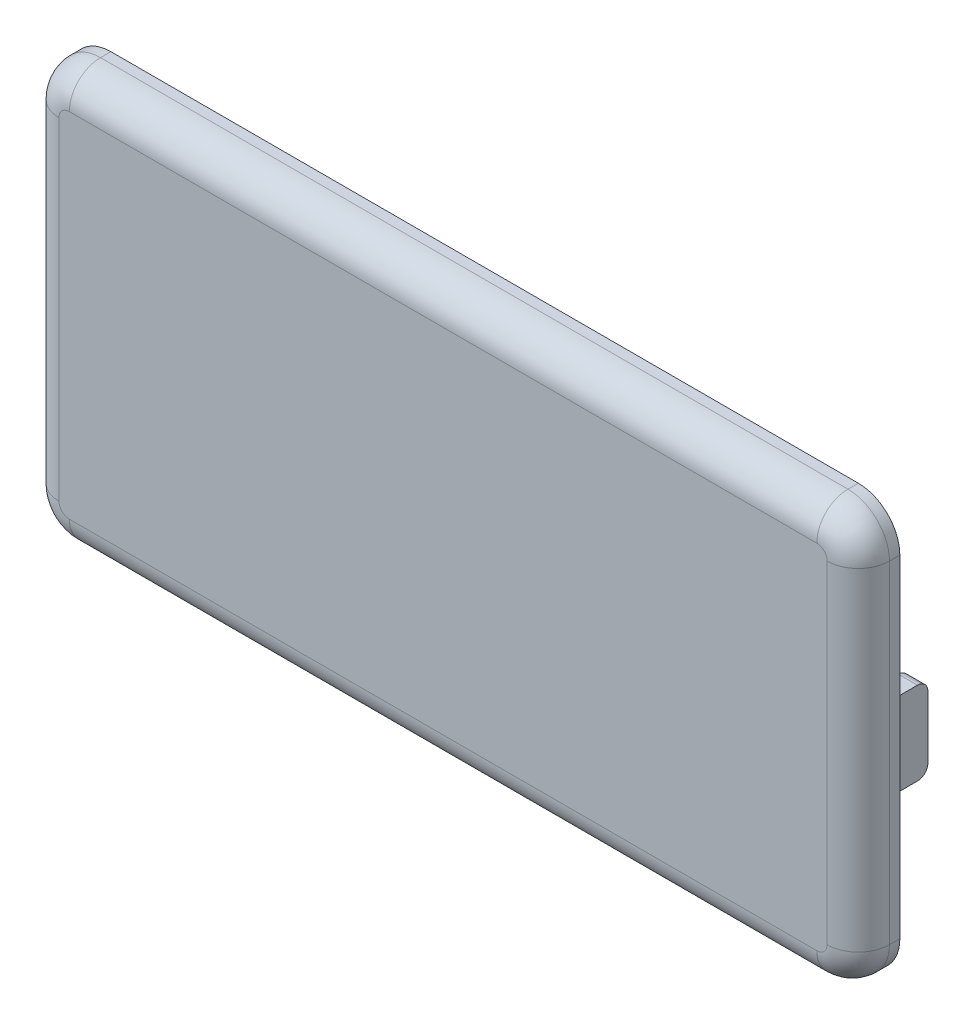
from build123d import *

# Parameters (mm, degrees)
SKETCH1_W           = 80
SKETCH1_H           = 40
BOSS_EXTRUDE1_DEPTH = 4
FILLET1_R           = 4
FILLET2_R           = 3
SKETCH2_W           = 74
SKETCH2_H           = 34
CUT_EXTRUDE1_DEPTH  = 1
BOSS_EXTRUDE2_DEPTH = 4
FILLET3_R           = 1
BOSS_EXTRUDE3_DEPTH = 9.5
LPATTERN1_COUNT     = 2
LPATTERN1_PITCH     = 40


with BuildPart() as part:
    # Sketch1 → Boss-Extrude1 (new body)
    with BuildSketch(Plane.XY):
        Rectangle(SKETCH1_W, SKETCH1_H)
    extrude(amount=BOSS_EXTRUDE1_DEPTH)

    # Fillet1
    fillet1_edges = [part.edges().sort_by_distance(p)[0] for p in [
        (-40, 20, 2),
        (40, 20, 2),
        (40, -20, 2),
        (-40, -20, 2),
    ]]
    fillet(fillet1_edges, radius=FILLET1_R)

    # Fillet2
    fillet2_edges = [part.edges().sort_by_distance(p)[0] for p in [
        (0, -20, 4),
        (-40, 0, 4),
        (40, 0, 4),
        (0, 20, 4),
        (-38.828427125, 18.828427125, 4),
        (38.828427125, 18.828427125, 4),
        (38.828427125, -18.828427125, 4),
        (-38.828427125, -18.828427125, 4),
    ]]
    fillet(fillet2_edges, radius=FILLET2_R)

    # Sketch2 → Cut-Extrude1 (cut)
    with BuildSketch(Plane(origin=(0, 0, 0), x_dir=(-1, 0, 0), z_dir=(0, 0, -1))):
        Rectangle(SKETCH2_W, SKETCH2_H)
    extrude(amount=-CUT_EXTRUDE1_DEPTH, mode=Mode.SUBTRACT)

    # Sketch3 → Boss-Extrude2 (add, symmetric)
    with BuildSketch(Plane(origin=(0, 0, 0), x_dir=(0, 0, -1), z_dir=(0, 1, 0))):
        Polygon((0, -37), (3, -38.091910703), (3, -39.7), (0, -39.7), align=None)
    extrude(amount=BOSS_EXTRUDE2_DEPTH, both=True)

    # Fillet3
    fillet3_edges = [part.edges().sort_by_distance(p)[0] for p in [
        (38.895955351, -4, -3),
        (38.895955351, 4, -3),
    ]]
    fillet(fillet3_edges, radius=FILLET3_R)

    # Sketch4 → Boss-Extrude3 (add)
    with BuildSketch(Plane(origin=(0, 0, 1), x_dir=(-1, 0, 0), z_dir=(0, 0, -1))):
        with BuildLine():
            Line((-23.301893396, -1), (-21, -1))
            Line((-21, -1), (-21, -3.301893396))
            ThreePointArc((-21, -3.301893396), (-20, -3.45), (-19, -3.301893396))
            Line((-19, -3.301893396), (-19, -1))
            Line((-19, -1), (-16.698106604, -1))
            ThreePointArc((-16.698106604, -1), (-16.55, 0), (-16.698106604, 1))
            Line((-16.698106604, 1), (-19, 1))
            Line((-19, 1), (-19, 3.301893396))
            ThreePointArc((-19, 3.301893396), (-20, 3.45), (-21, 3.301893396))
            Line((-21, 3.301893396), (-21, 1))
            Line((-21, 1), (-23.301893396, 1))
            ThreePointArc((-23.301893396, 1), (-23.45, 0), (-23.301893396, -1))
        make_face()
    boss_extrude3 = extrude(amount=BOSS_EXTRUDE3_DEPTH)

    # Sketch5 → Cut-Revolve1 (revolve, cut)
    with BuildSketch(Plane(origin=(0, 0, 0), x_dir=(0, 0, -1), z_dir=(0, 1, 0))):
        with BuildLine():
            Line((5.5, -16.55), (8.5, -16.55))
            Line((8.5, -16.55), (8.5, -17.498530758))
            ThreePointArc((8.5, -17.498530758), (8.383022222, -17.177136953), (8.086824089, -17.006126881))
            Line((8.086824089, -17.006126881), (5.5, -16.55))
        make_face()
    cut_revolve1 = revolve(axis=Axis((20, 0, 1), (0, 0, -1)), mode=Mode.SUBTRACT)

    # LPattern1: Boss-Extrude3, Cut-Revolve1 ×2
    with Locations(*[(-i * LPATTERN1_PITCH, 0, 0) for i in range(1, LPATTERN1_COUNT)]):
        add(boss_extrude3)
        add(cut_revolve1, mode=Mode.SUBTRACT)


solid = part.part
